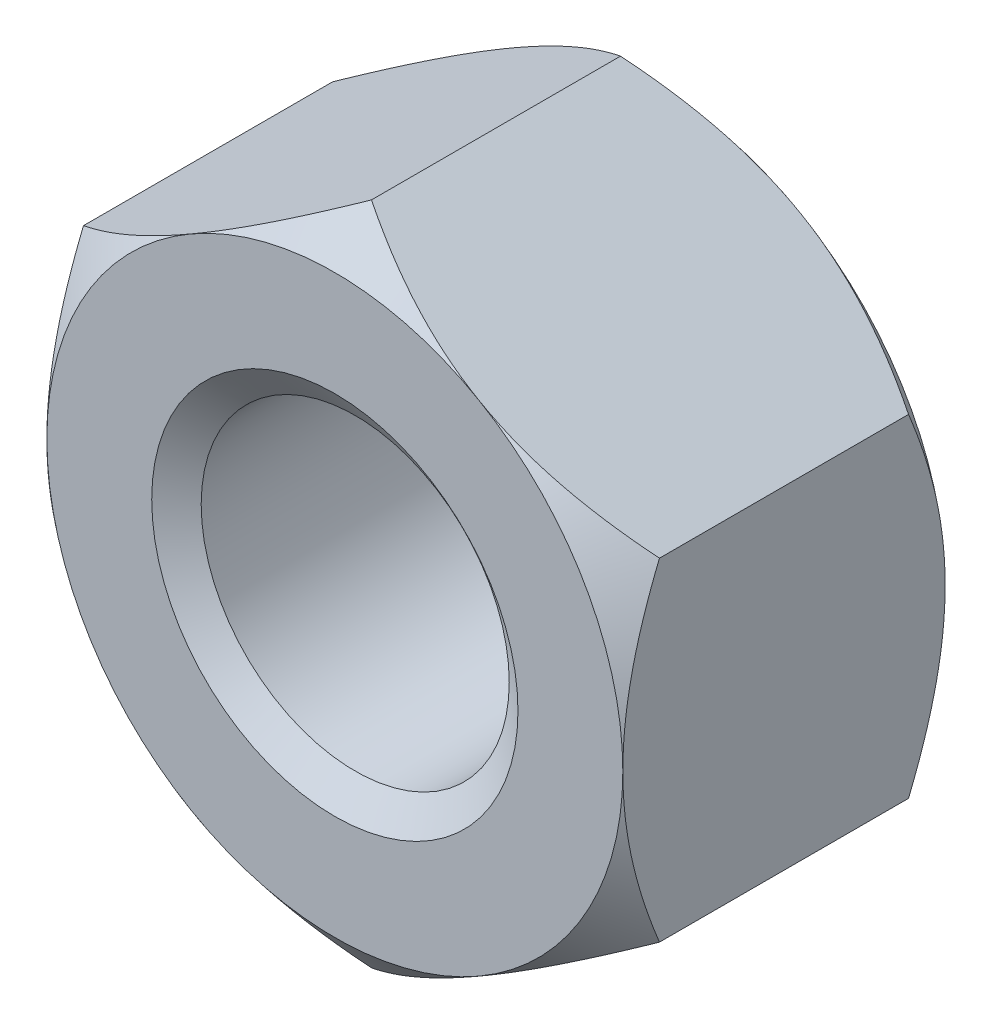
from build123d import *

# Parameters (mm, degrees)
BASENUTSKE_R  = 4.6736
BASENUT_DEPTH = 9.779


with BuildPart() as part:
    # BaseNutSke → BaseNut (new body)
    with BuildSketch(Plane.XY):
        Polygon((8.7376, 5.044655712), (8.7376, -5.044655712), (0, -10.089311424), (-8.7376, -5.044655712), (-8.7376, 5.044655712), (0, 10.089311424), align=None)
        Circle(BASENUTSKE_R, mode=Mode.SUBTRACT)
    extrude(amount=-BASENUT_DEPTH)

    # Sketch3 → Double-Chamfer (revolve, cut)
    with BuildSketch(Plane(origin=(0, 0, 0), x_dir=(0, 0, -1), z_dir=(1, 0, 0))):
        Polygon((9.779, 8.7376), (8.66775, 10.089311424), (8.66775, 22.789311424), (22.479, 22.789311424), (22.479, 8.7376), align=None)
        Polygon((1.11125, 22.789311424), (-12.7, 22.789311424), (-12.7, 8.7376), (0, 8.7376), (1.11125, 10.089311424), align=None)
    revolve(axis=Axis((0, 0, 0), (0, 0, -1)), mode=Mode.SUBTRACT)

    # Sketch5 → EndChamfer (revolve, cut)
    with BuildSketch(Plane(origin=(0, 0, 0), x_dir=(0, 0, -1), z_dir=(1, 0, 0)), mode=Mode.PRIVATE) as endchamfer_sk:
        Polygon((9.7536, 5.55625), (9.073757998, 4.585335), (9.8044, 4.585335), (9.8044, 5.55625), align=None)
        Polygon((-0.0508, 5.55625), (0, 5.55625), (0.679842002, 4.585335), (-0.0508, 4.585335), align=None)
    revolve(endchamfer_sk.sketch.rotate(Axis((0, 0, -25.037505729), (0, 0, -1)), 90), axis=Axis((0, 0, -25.037505729), (0, 0, -1)), mode=Mode.SUBTRACT)


solid = part.part
